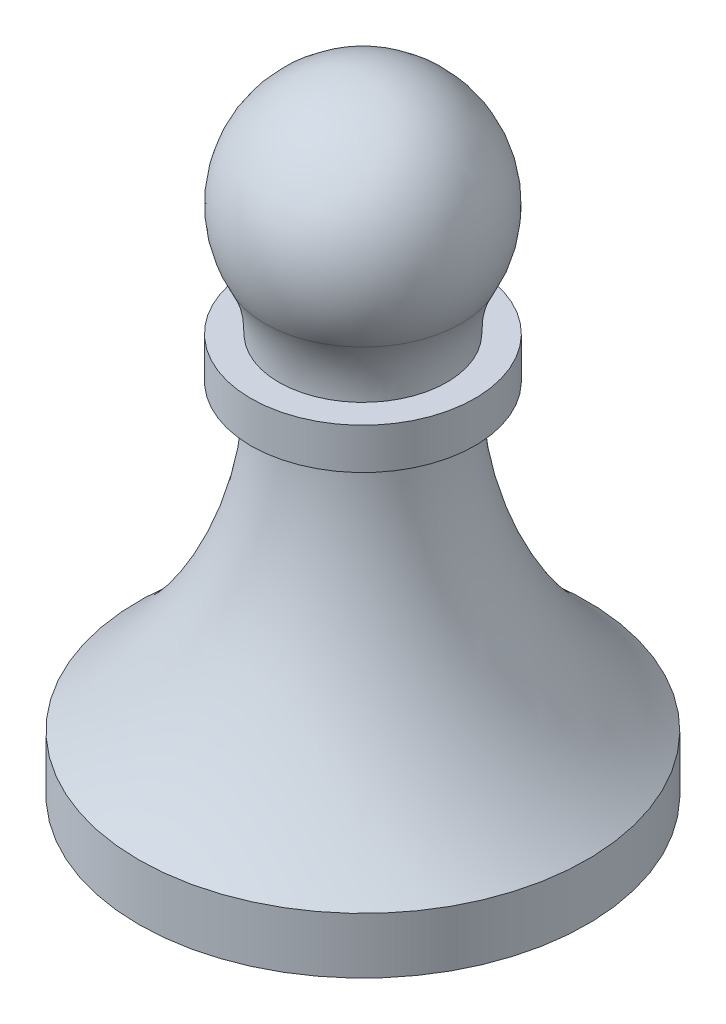
from build123d import *

# Parameters (mm, degrees)
SKETCH1_W     = 20
SKETCH1_H     = 5
SCALE_1_SCALE = 0.6


with BuildPart() as part:
    # Sketch1 → Revolve2 (revolve)
    with BuildSketch(Plane.XY, mode=Mode.PRIVATE) as revolve2_sk:
        with Locations((10, -29.5)):
            Rectangle(SKETCH1_W, SKETCH1_H)
        with BuildLine():
            Line((7.5, 0), (0, 0))
            Line((0, 0), (0, -27))
            Line((0, -27), (20, -27))
            ThreePointArc((20, -27), (10.738142241, -14.894378592), (7.5, 0))
        make_face()
        with BuildLine():
            ThreePointArc((8.747613634, 8.812516428), (8.61554983, 18.734698905), (0, 23.658056202))
            Line((0, 23.658056202), (0, 3.658056202))
            Line((0, 3.658056202), (7.5, 3.658056202))
            ThreePointArc((7.5, 3.658056202), (7.775883858, 6.319499484), (8.747613634, 8.812516428))
        make_face()
        Polygon((7.5, 3.658056202), (0, 3.658056202), (0, 0), (7.5, 0), (10, 0), (10, 3.658056202), align=None)
    revolve(revolve2_sk.sketch.rotate(Axis((0, 36.358430306, 0), (0, -1, 0)), 90), axis=Axis((0, 36.358430306, 0), (0, -1, 0)))


with BuildPart() as part_1:
    # 缩放比例1: scaled about (0, 0, 0)
    add(part.part.scale(SCALE_1_SCALE))


solid = part_1.part
